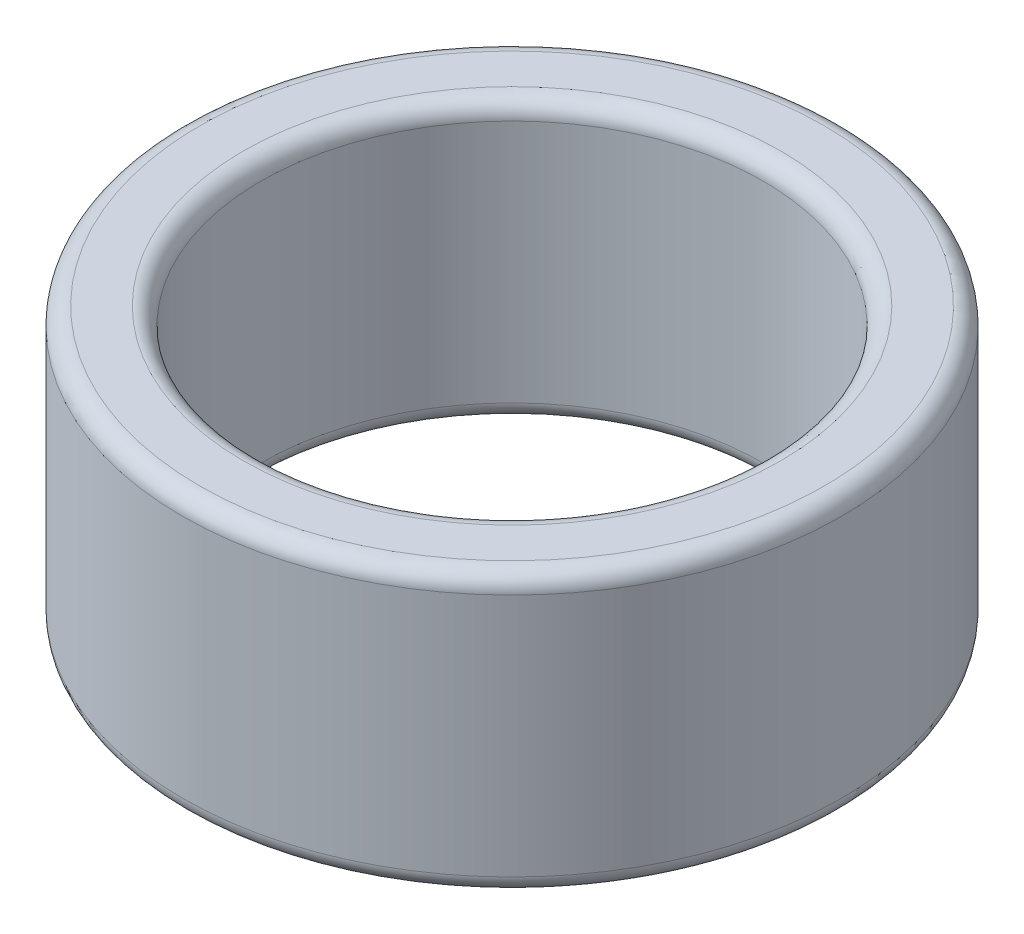
from build123d import *

# Parameters (mm, degrees)
SKETCH1_R           = 9.45
SKETCH1_R_2         = 7.2
BOSS_EXTRUDE1_DEPTH = 8
FILLET1_R           = 0.5


with BuildPart() as part:
    # Sketch1 → Boss-Extrude1 (new body)
    with BuildSketch(Plane(origin=(0, 0, 0), x_dir=(1, 0, 0), z_dir=(0, 1, 0))):
        with Locations(Location((0, 0, 0), (0, 0, 270))):
            Circle(SKETCH1_R)
        with Locations(Location((0, 0, 0), (0, 0, 270))):
            Circle(SKETCH1_R_2, mode=Mode.SUBTRACT)
    extrude(amount=BOSS_EXTRUDE1_DEPTH)

    # Fillet1
    fillet1_edges = [part.edges().sort_by_distance(p)[0] for p in [
        (0, 0, -9.45),
        (0, 8, -9.45),
        (0, 0, -7.2),
        (0, 8, -7.2),
    ]]
    fillet(fillet1_edges, radius=FILLET1_R)


solid = part.part
